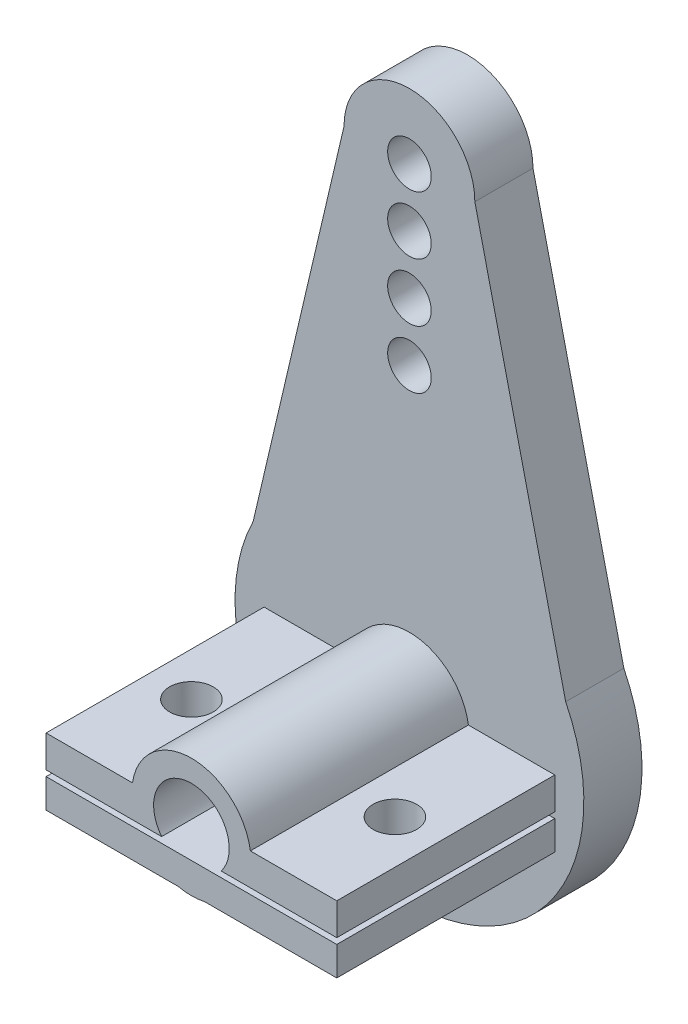
from build123d import *

# Parameters (mm, degrees)
SZKIC1_R                      = 12
DODANIE_WYCI_GNI_CIE2_DEPTH   = 4
SZKIC1_R_2                    = 4.5
DODANIE_WYCI_GNI_CIE2_2_DEPTH = 4
DODANIE_WYCI_GNI_CIE3_DEPTH   = 4
WYTNIJ_WYCI_GNI_CIE1_REACH    = 40.63
SZKIC3_R                      = 1.5
SZKIC4_R                      = 4.1
SZKIC4_R_2                    = 2.6
DODANIE_WYCI_GNI_CIE4_DEPTH   = 15
SZKIC5_W                      = 20
SZKIC5_H                      = 2
DODANIE_WYCI_GNI_CIE5_DEPTH   = 15
SZKIC6_W                      = 16
SZKIC6_H                      = 0.4
WYTNIJ_WYCI_GNI_CIE2_DEPTH    = 15
SZKIC7_W                      = 6.95515277
SZKIC7_H                      = 2.2
SZKIC7_W_2                    = 6.645937882
DODANIE_WYCI_GNI_CIE6_DEPTH   = 15
SZKIC10_R                     = 1.5
WYTNIJ_WYCI_GNI_CIE4_DEPTH    = 5


with BuildPart() as part:
    # Szkic1 → Dodanie-wyciągnięcie2 (new body)
    with BuildSketch(Plane.XY):
        Circle(SZKIC1_R)
    extrude(amount=DODANIE_WYCI_GNI_CIE2_DEPTH)



with BuildPart() as body_2:
    # Szkic1 → Dodanie-wyci_gni_cie2 2 (new body)
    with BuildSketch(Plane.XY):
        with Locations((0, 32)):
            Circle(SZKIC1_R_2)
    extrude(amount=DODANIE_WYCI_GNI_CIE2_2_DEPTH)


with BuildPart() as part_1:
    add(part.part)

    add(body_2.part)  # Dodanie-wyciągnięcie3 merges body 2
    # Szkic2 → Dodanie-wyciągnięcie3 (add)
    with BuildSketch(Plane(origin=(0, 0, 0), x_dir=(-1, 0, 0), z_dir=(0, 0, -1))):
        Polygon((-4.5, 32), (-12, 0), (12, 0), (4.5, 32), align=None)
    extrude(amount=-DODANIE_WYCI_GNI_CIE3_DEPTH)

    # Szkic3 → Wytnij-wyciągnięcie1 (cut, up to next)
    with BuildSketch(Plane(origin=(0, 0, 0), x_dir=(-1, 0, 0), z_dir=(0, 0, -1)), mode=Mode.PRIVATE) as wytnij_wyci_gni_cie1_sk1:
        with Locations((0, 32)):
            Circle(SZKIC3_R)
    wytnij_wyci_gni_cie1_tool1 = extrude(wytnij_wyci_gni_cie1_sk1.sketch, amount=-WYTNIJ_WYCI_GNI_CIE1_REACH, mode=Mode.PRIVATE) & part_1.part
    # Szkic3 → Wytnij-wyciągnięcie1 (cut, up to next)
    with BuildSketch(Plane(origin=(0, 0, 0), x_dir=(-1, 0, 0), z_dir=(0, 0, -1)), mode=Mode.PRIVATE) as wytnij_wyci_gni_cie1_sk2:
        with Locations((0, 28)):
            Circle(SZKIC3_R)
    wytnij_wyci_gni_cie1_tool2 = extrude(wytnij_wyci_gni_cie1_sk2.sketch, amount=-WYTNIJ_WYCI_GNI_CIE1_REACH, mode=Mode.PRIVATE) & part_1.part
    # Szkic3 → Wytnij-wyciągnięcie1 (cut, up to next)
    with BuildSketch(Plane(origin=(0, 0, 0), x_dir=(-1, 0, 0), z_dir=(0, 0, -1)), mode=Mode.PRIVATE) as wytnij_wyci_gni_cie1_sk3:
        with Locations((0, 24)):
            Circle(SZKIC3_R)
    wytnij_wyci_gni_cie1_tool3 = extrude(wytnij_wyci_gni_cie1_sk3.sketch, amount=-WYTNIJ_WYCI_GNI_CIE1_REACH, mode=Mode.PRIVATE) & part_1.part
    # Szkic3 → Wytnij-wyciągnięcie1 (cut, up to next)
    with BuildSketch(Plane(origin=(0, 0, 0), x_dir=(-1, 0, 0), z_dir=(0, 0, -1)), mode=Mode.PRIVATE) as wytnij_wyci_gni_cie1_sk4:
        with Locations((0, 20)):
            Circle(SZKIC3_R)
    wytnij_wyci_gni_cie1_tool4 = extrude(wytnij_wyci_gni_cie1_sk4.sketch, amount=-WYTNIJ_WYCI_GNI_CIE1_REACH, mode=Mode.PRIVATE) & part_1.part
    add(wytnij_wyci_gni_cie1_tool1.solids().sort_by_distance((0, 32, 0))[0], mode=Mode.SUBTRACT)
    add(wytnij_wyci_gni_cie1_tool2.solids().sort_by_distance((0, 28, 0))[0], mode=Mode.SUBTRACT)
    add(wytnij_wyci_gni_cie1_tool3.solids().sort_by_distance((0, 24, 0))[0], mode=Mode.SUBTRACT)
    add(wytnij_wyci_gni_cie1_tool4.solids().sort_by_distance((0, 20, 0))[0], mode=Mode.SUBTRACT)

    # Szkic4 → Dodanie-wyciągnięcie4 (add)
    with BuildSketch(Plane.XY.offset(4)):
        Circle(SZKIC4_R)
        Circle(SZKIC4_R_2, mode=Mode.SUBTRACT)
    extrude(amount=DODANIE_WYCI_GNI_CIE4_DEPTH)

    # Szkic5 → Dodanie-wyciągnięcie5 (add)
    with BuildSketch(Plane.XY.offset(4)):
        with Locations((0, -3)):
            Rectangle(SZKIC5_W, SZKIC5_H)
    extrude(amount=DODANIE_WYCI_GNI_CIE5_DEPTH)

    # Szkic6 → Wytnij-wyciągnięcie2 (cut)
    with BuildSketch(Plane.XY.offset(4)):
        with Locations((-2, -1.8)):
            Rectangle(SZKIC6_W, SZKIC6_H)
    extrude(amount=WYTNIJ_WYCI_GNI_CIE2_DEPTH, mode=Mode.SUBTRACT)

    # Szkic7 → Dodanie-wyciągnięcie6 (add)
    with BuildSketch(Plane.XY.offset(4)):
        with Locations((-6.522423615, -0.5)):
            Rectangle(SZKIC7_W, SZKIC7_H)
        with Locations((6.677031059, -0.5)):
            Rectangle(SZKIC7_W_2, SZKIC7_H)
    extrude(amount=DODANIE_WYCI_GNI_CIE6_DEPTH)

    # Szkic10 → Wytnij-wyciągnięcie4 (cut)
    with BuildSketch(Plane(origin=(0, 0.6, 0), x_dir=(1, 0, 0), z_dir=(0, 1, 0))):
        with Locations(Location((-7, -12, 0), (0, 0, 180))):
            Circle(SZKIC10_R)
        with Locations(Location((7, -12, 0), (0, 0, 180))):
            Circle(SZKIC10_R)
    extrude(amount=-WYTNIJ_WYCI_GNI_CIE4_DEPTH, mode=Mode.SUBTRACT)


solid = part_1.part
